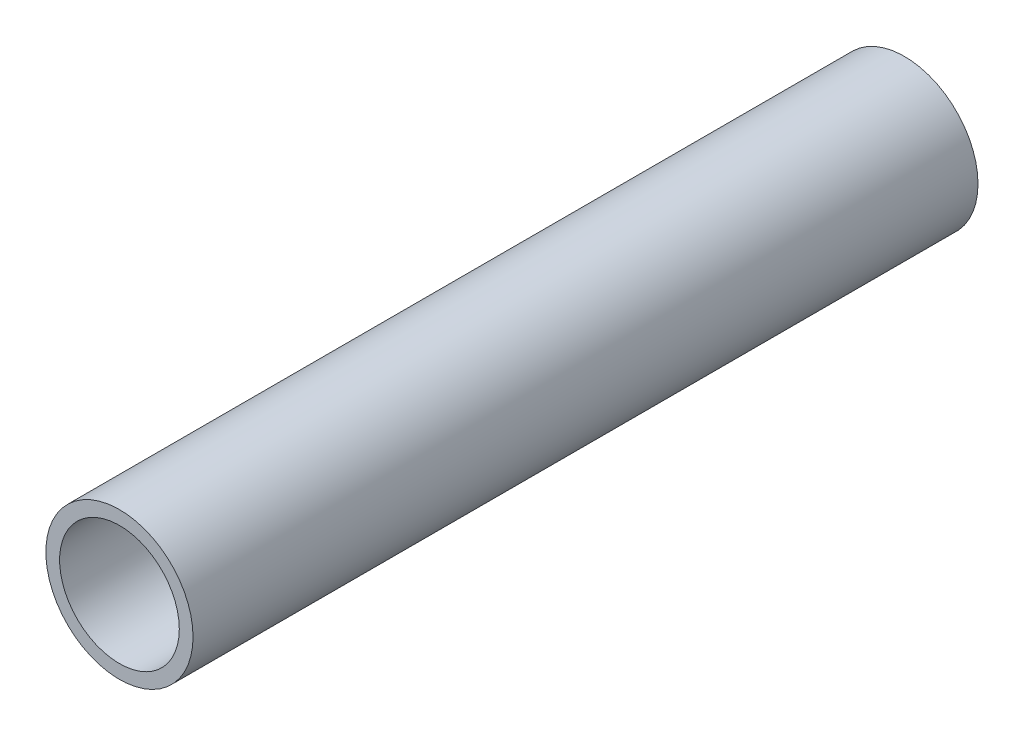
from build123d import *

# Parameters (mm, degrees)
SKETCH_1_W          = 1.4
SKETCH_1_H          = 200
CUT_EXTRUDE_START   = -120
SKETCH_2_R          = 7.5
CUT_EXTRUDE_1_DEPTH = 120


with BuildPart() as part:
    # 스케치1 → 회전1 (revolve)
    with BuildSketch(Plane(origin=(0, 0, 0), x_dir=(1, 0, 0), z_dir=(0, 1, 0))):
        with Locations((6.8, -100)):
            Rectangle(SKETCH_1_W, SKETCH_1_H)
    revolve(axis=Axis((0, 0, 0), (0, 0, 1)))

    # 스케치2 → 컷-돌출1 (cut)
    with BuildSketch(Plane.XY.offset(200).offset(CUT_EXTRUDE_START)):
        Circle(SKETCH_2_R)
    extrude(amount=CUT_EXTRUDE_1_DEPTH, mode=Mode.SUBTRACT)


solid = part.part
